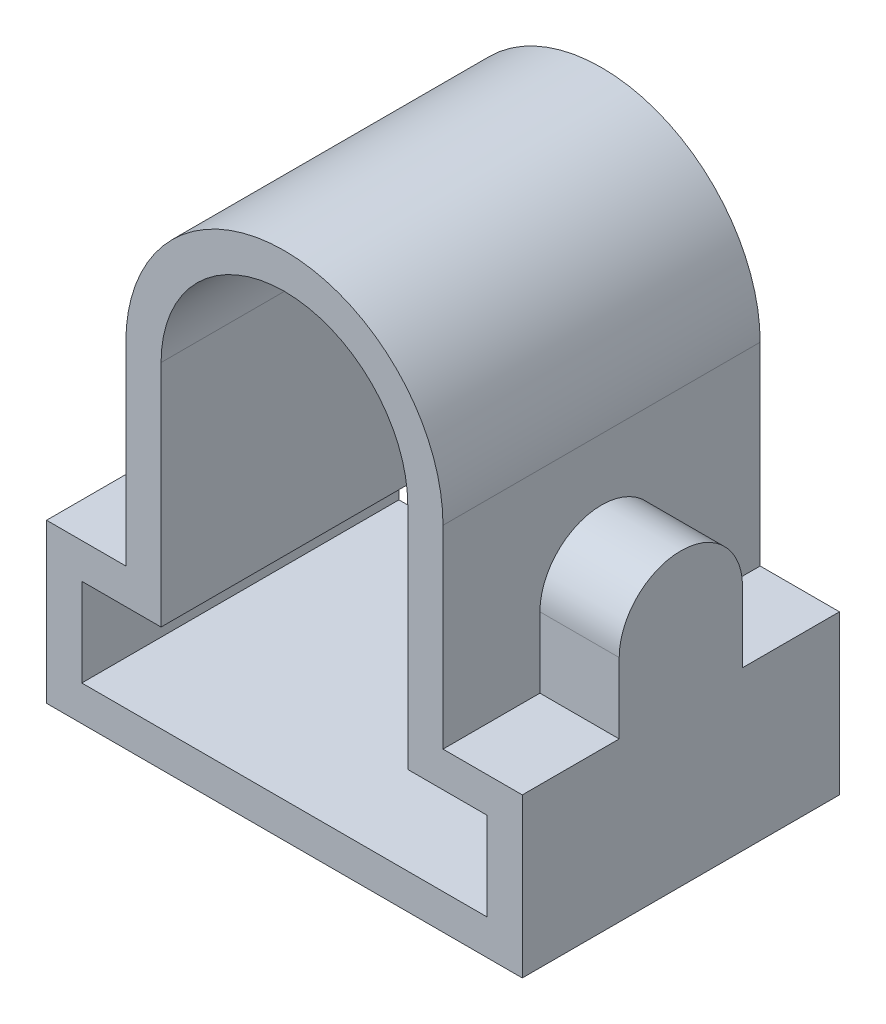
from build123d import *

# Parameters (mm, degrees)
BOSS_EXTRUDE1_DEPTH      = 45
BOSS_EXTRUDE1_DEPTH_BACK = 45
BOSS_EXTRUDE2_DEPTH      = 22.5


with BuildPart() as part:
    # Sketch1 → Boss-Extrude1 (new, two sides: drawn at the far end of the back side and taken through both)
    with BuildSketch(Plane.XY.offset(-BOSS_EXTRUDE1_DEPTH_BACK)):
        with BuildLine():
            Line((-67.5, 0), (67.5, 0))
            Line((67.5, 0), (67.5, 45))
            Line((67.5, 45), (45, 45))
            Line((45, 45), (45, 100))
            ThreePointArc((45, 100), (0, 145), (-45, 100))
            Line((-45, 100), (-45, 45))
            Line((-45, 45), (-67.5, 45))
            Line((-67.5, 45), (-67.5, 0))
        make_face()
        with BuildLine():
            Line((-35, 35), (-35, 100))
            ThreePointArc((-35, 100), (0, 135), (35, 100))
            Line((35, 100), (35, 35))
            Line((35, 35), (57.5, 35))
            Line((57.5, 35), (57.5, 10))
            Line((57.5, 10), (-57.5, 10))
            Line((-57.5, 10), (-57.5, 35))
            Line((-57.5, 35), (-35, 35))
        make_face(mode=Mode.SUBTRACT)
    extrude(amount=BOSS_EXTRUDE1_DEPTH + BOSS_EXTRUDE1_DEPTH_BACK)

    # Sketch2 → Boss-Extrude2 (add)
    with BuildSketch(Plane(origin=(45, 0, 0), x_dir=(0, 0, -1), z_dir=(1, 0, 0))):
        with BuildLine():
            Line((17.5, 65), (17.5, 45))
            Line((17.5, 45), (-17.5, 45))
            Line((-17.5, 45), (-17.5, 65))
            ThreePointArc((-17.5, 65), (0, 82.5), (17.5, 65))
        make_face()
    extrude(amount=BOSS_EXTRUDE2_DEPTH)


solid = part.part
